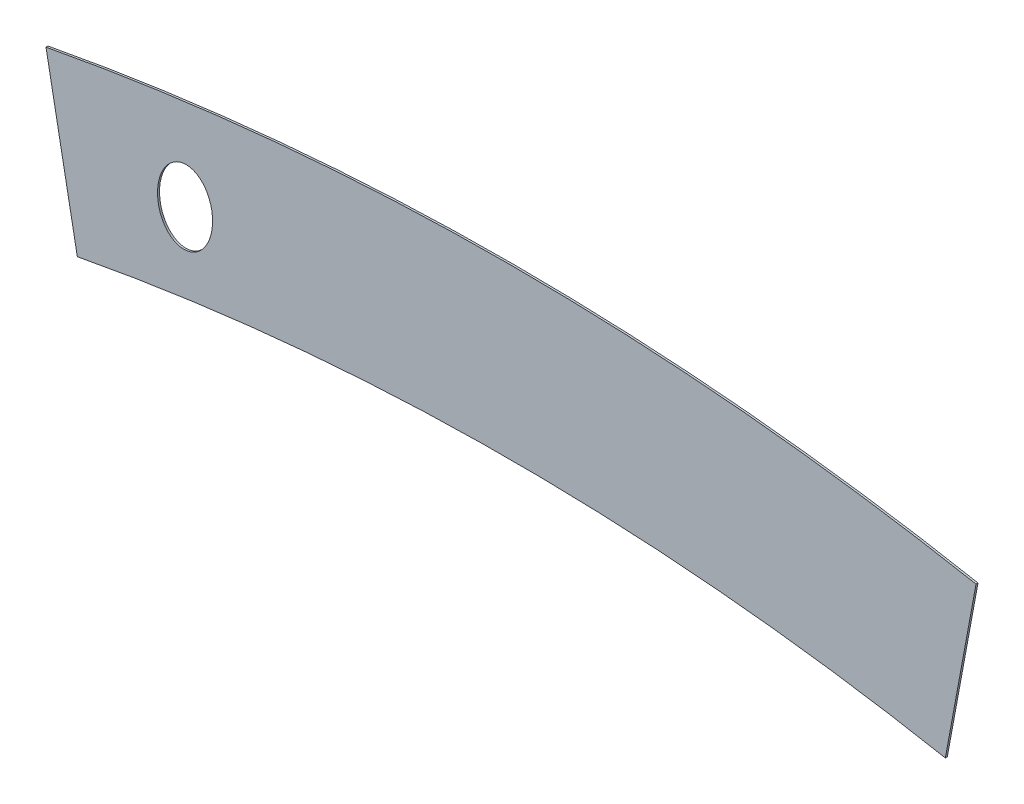
from build123d import *

# Parameters (mm, degrees)
SKETCH1_RX         = 60.325
SKETCH1_RY         = 44.45
BASE_EXTRUDE_DEPTH = 3.175


with BuildPart() as part:
    # Sketch1 → Base-Extrude (new body)
    with BuildSketch(Plane.XY):
        with BuildLine():
            Line((-752.475, -70.773505599), (-701.7766, -339.075622164))
            ThreePointArc((-701.7766, -339.075622164), (0.530014677, -273.05003733), (702.818, -339.273481384))
            Line((702.818, -339.273481384), (752.475, -70.773505599))
            ThreePointArc((752.475, -70.773505599), (0, 0), (-752.475, -70.773505599))
        make_face()
        with Locations(Location((-527.440710052, -182.216417238), (0, 0, -93.81))):
            Ellipse(SKETCH1_RX, SKETCH1_RY, mode=Mode.SUBTRACT)
    extrude(amount=-BASE_EXTRUDE_DEPTH)


solid = part.part
